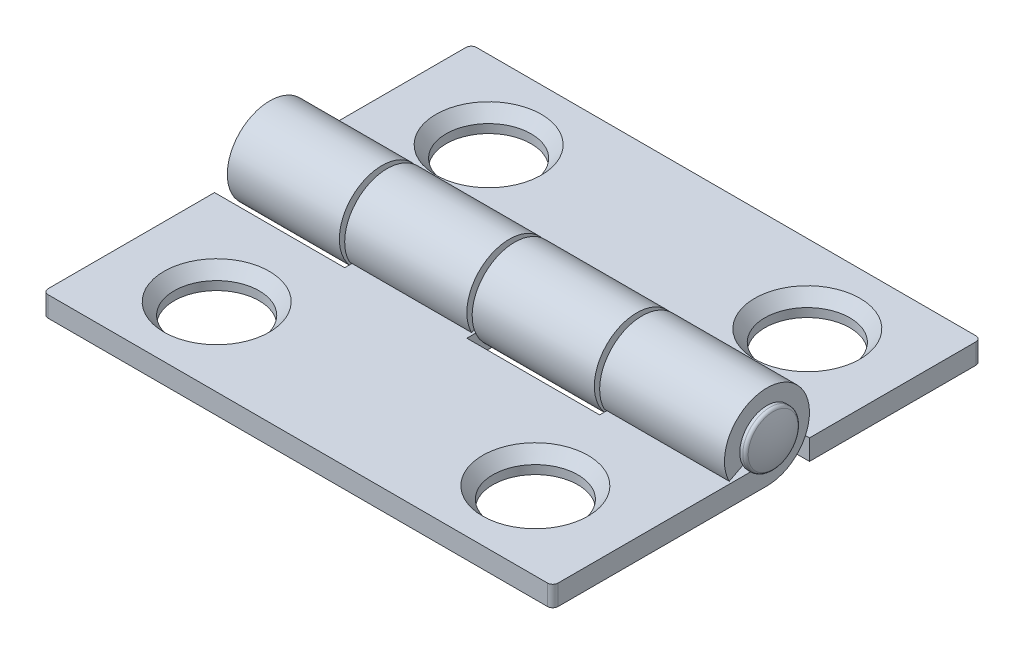
from build123d import *

# Parameters (mm, degrees)
BOSS_EXTRUDE1_DEPTH     = 19.05
SKETCH4_W               = 9.525
SKETCH4_H               = 6.35
CUT_EXTRUDE1_DEPTH      = 26.080811969
LPATTERN1_COUNT         = 2
LPATTERN1_PITCH         = 19.05
CUT_EXTRUDE2_DEPTH      = 26.342785561
CUT_EXTRUDE2_DEPTH_BACK = 26.342785561
SKETCH5_W               = 0.1984375
SKETCH5_H               = 6.35
SKETCH6_R               = 3.175
CUT_EXTRUDE3_DEPTH      = 26.342785561
FILLET1_R               = 0.396875
CIRPATTERN1_COUNT       = 2
SKETCH8_R               = 1.651
BOSS_EXTRUDE2_DEPTH     = 19.05
SKETCH10_W              = 0.9525
SKETCH10_H              = 6.35
CUT_EXTRUDE5_DEPTH      = 27.270913918
CHAMFER1_SIZE           = 0.1651


with BuildPart() as part:
    # Sketch3 → Boss-Extrude1 (new, symmetric)
    with BuildSketch(Plane(origin=(0, 0, 0), x_dir=(0, 0, -1), z_dir=(1, 0, 0))):
        with BuildLine():
            Line((0, -3.175), (-16.002, -3.175))
            Line((-16.002, -3.175), (-16.002, -1.651))
            Line((-16.002, -1.651), (0, -1.651))
            ThreePointArc((0, -1.651), (0.856809561, 1.411268357), (-1.464794939, -0.761693368))
            Line((-1.464794939, -0.761693368), (-2.816913344, -1.464794939))
            ThreePointArc((-2.816913344, -1.464794939), (1.647710695, 2.71397761), (0, -3.175))
        make_face()
    extrude(amount=BOSS_EXTRUDE1_DEPTH, both=True)

    # Sketch4 → Cut-Extrude1 (cut, symmetric)
    with BuildSketch(Plane(origin=(0, 0, 0), x_dir=(1, 0, 0), z_dir=(0, 1, 0))):
        with Locations((4.7625, 0)):
            Rectangle(SKETCH4_W, SKETCH4_H)
    cut_extrude1 = extrude(amount=CUT_EXTRUDE1_DEPTH, both=True, mode=Mode.SUBTRACT)

    # LPattern1: Cut-Extrude1 ×2
    with Locations(*[(-i * LPATTERN1_PITCH, 0, 0) for i in range(1, LPATTERN1_COUNT)]):
        add(cut_extrude1, mode=Mode.SUBTRACT)

    # Sketch5 → Cut-Extrude2 (cut, two sides: drawn at the far end of the back side and taken through both)
    with BuildSketch(Plane(origin=(0, -1.651, 0), x_dir=(1, 0, 0), z_dir=(0, 1, 0)).offset(-CUT_EXTRUDE2_DEPTH_BACK)):
        with Locations((-9.42578125, 0)):
            Rectangle(SKETCH5_W, SKETCH5_H)
        with Locations((-0.09921875, 0)):
            Rectangle(SKETCH5_W, SKETCH5_H)
        with Locations((9.62421875, 0)):
            Rectangle(SKETCH5_W, SKETCH5_H)
    extrude(amount=CUT_EXTRUDE2_DEPTH + CUT_EXTRUDE2_DEPTH_BACK, mode=Mode.SUBTRACT)

    # Sketch6 → Cut-Extrude3 (cut, through all)
    with BuildSketch(Plane(origin=(0, -1.651, 0), x_dir=(1, 0, 0), z_dir=(0, 1, 0))):
        with Locations(Location((11.90625, -10.16, 0), (0, 0, 270))):
            Circle(SKETCH6_R)
        with Locations(Location((-11.90625, -10.16, 0), (0, 0, 270))):
            Circle(SKETCH6_R)
    extrude(amount=-CUT_EXTRUDE3_DEPTH, mode=Mode.SUBTRACT)

    # Cut-Extrude4 cone 1 section (through the dimple's axis) → Cut-Extrude4 (revolve, cut)
    with BuildSketch(Plane(origin=(-11.90625, -1.651, 10.16), x_dir=(0, 0, 1), z_dir=(1, 0, 0))):
        Polygon((0, 0), (3.937, 0), (0, 4.529000419), align=None)
    revolve(axis=Axis((-11.90625, -1.651, 10.16), (0, -1, 0)), mode=Mode.SUBTRACT)

    # Cut-Extrude4 cone 2 section (through the dimple's axis) → Cut-Extrude4 cone 2 (revolve, cut)
    with BuildSketch(Plane(origin=(11.90625, -1.651, 10.16), x_dir=(0, 0, 1), z_dir=(1, 0, 0))):
        Polygon((0, 0), (3.937, 0), (0, 4.529000419), align=None)
    revolve(axis=Axis((11.90625, -1.651, 10.16), (0, -1, 0)), mode=Mode.SUBTRACT)

    # Fillet1
    fillet1_edges = [part.edges().sort_by_distance(p)[0] for p in [
        (19.05, -2.413, 16.002),
        (-19.05, -2.413, 16.002),
    ]]
    fillet(fillet1_edges, radius=FILLET1_R)


with BuildPart() as cirpattern1_1:
    # CirPattern1: pattern copy
    add(part.part.rotate(Axis((0, 0, 0), (0, 1, 0)), 1 * 360 / CIRPATTERN1_COUNT))

    # Sketch10 → Cut-Extrude5 (cut, through all)
    with BuildSketch(Plane.XZ.offset(3.175)):
        with Locations((-18.57375, 0)):
            Rectangle(SKETCH10_W, SKETCH10_H)
    extrude(amount=-CUT_EXTRUDE5_DEPTH, mode=Mode.SUBTRACT)


with BuildPart() as body_3:
    # Sketch8 → Boss-Extrude2 (new, symmetric)
    with BuildSketch(Plane(origin=(0, 0, 0), x_dir=(0, 0, -1), z_dir=(1, 0, 0))):
        with Locations(Location((0, 0, 0), (0, 0, 180))):
            Circle(SKETCH8_R)
    extrude(amount=BOSS_EXTRUDE2_DEPTH, both=True)

    # Sketch9 → Revolve1 (revolve)
    with BuildSketch(Plane.XY):
        with BuildLine():
            Line((19.05, 2.032), (19.05, 0))
            Line((19.05, 0), (19.84375, 0))
            ThreePointArc((19.84375, 0), (19.759966303, 0.947578032), (19.511214931, 1.865753717))
            ThreePointArc((19.511214931, 1.865753717), (19.418159448, 1.9863332), (19.27285536, 2.032))
            Line((19.27285536, 2.032), (19.05, 2.032))
        make_face()
    revolve(axis=Axis((19.05, 0, 0), (-1, 0, 0)))

    # Chamfer1
    chamfer1_edges = [body_3.edges().sort_by_distance(p)[0] for p in [
        (-19.05, 0, -1.651),
    ]]
    chamfer(chamfer1_edges, length=CHAMFER1_SIZE)


solid = Compound([part.part, cirpattern1_1.part, body_3.part])
